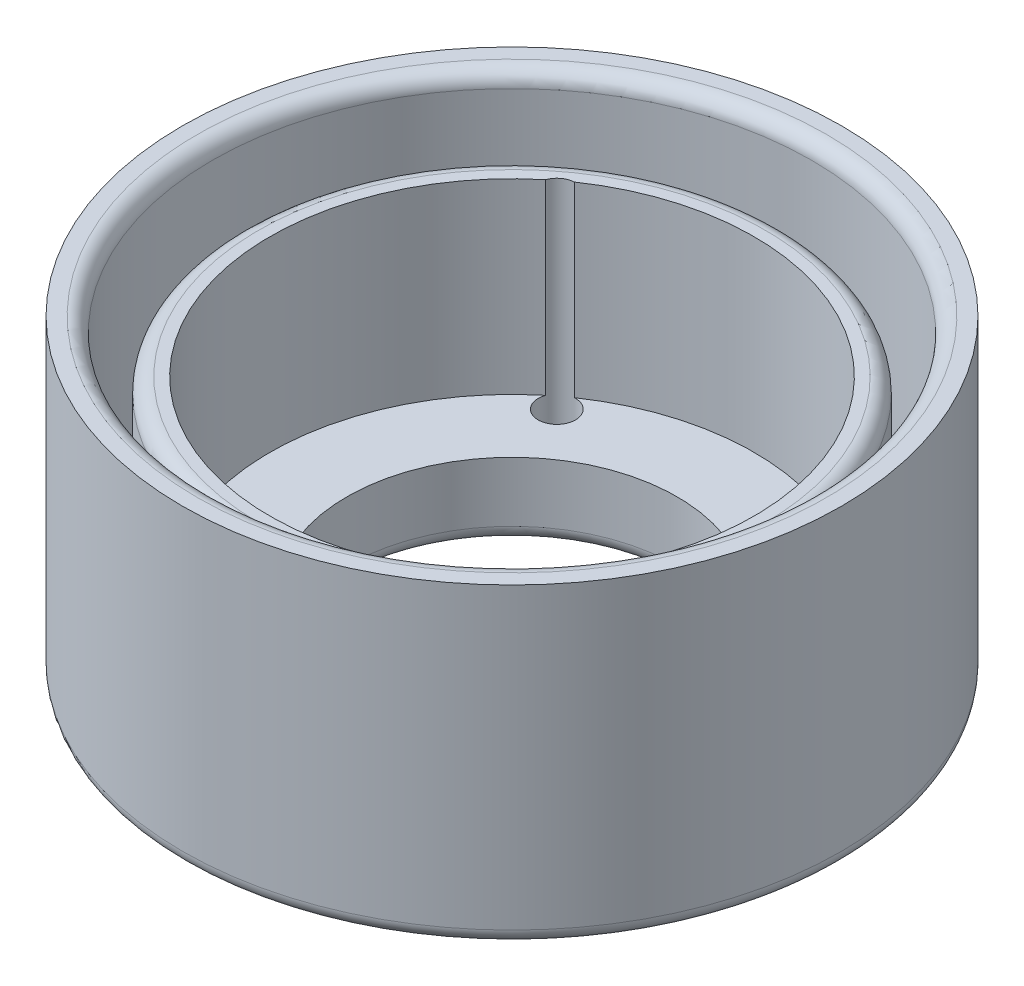
from build123d import *

# Parameters (mm, degrees)
CROQUIS1_R              = 22.05
CROQUIS1_R_2            = 20.05
SALIENTE_EXTRUIR1_DEPTH = 16
CROQUIS1_4_R            = 17.95
CROQUIS1_4_R_2          = 16.2
SALIENTE_EXTRUIR2_DEPTH = 12.5
SALIENTE_EXTRUIR4_START = -5
CROQUIS1_6_R            = 22.05
SALIENTE_EXTRUIR4_DEPTH = 5
CORTAR_EXTRUIR1_REACH   = 39.595
CROQUIS4_R              = 11.05
CROQUIS4_R_2            = 1.25
CROQUIS5_R              = 2.5
CROQUIS5_R_2            = 1.25
CORTAR_EXTRUIR2_DEPTH   = 3
REDONDEO1_R             = 1
REDONDEO3_R             = 1
REDONDEO4_R             = 1


with BuildPart() as part:
    # Croquis1 → Saliente-Extruir1 (new body)
    with BuildSketch(Plane(origin=(0, 0, 0), x_dir=(1, 0, 0), z_dir=(0, 1, 0))):
        Circle(CROQUIS1_R)
        Circle(CROQUIS1_R_2, mode=Mode.SUBTRACT)
    extrude(amount=SALIENTE_EXTRUIR1_DEPTH)



with BuildPart() as body_2:
    # Croquis1<4> → Saliente-Extruir2 (new body)
    with BuildSketch(Plane(origin=(0, 0, 0), x_dir=(1, 0, 0), z_dir=(0, 1, 0))):
        Circle(CROQUIS1_4_R)
        Circle(CROQUIS1_4_R_2, mode=Mode.SUBTRACT)
    extrude(amount=SALIENTE_EXTRUIR2_DEPTH)


with BuildPart() as part_1:
    add(part.part)

    add(body_2.part)  # Saliente-Extruir4 merges body 2
    # Croquis1<6> → Saliente-Extruir4 (add)
    with BuildSketch(Plane(origin=(0, 0, 0), x_dir=(1, 0, 0), z_dir=(0, 1, 0)).offset(SALIENTE_EXTRUIR4_START)):
        Circle(CROQUIS1_6_R)
    extrude(amount=SALIENTE_EXTRUIR4_DEPTH)

    # Croquis4 → Cortar-Extruir1 (cut, up to next)
    with BuildSketch(Plane.XZ.offset(5), mode=Mode.PRIVATE) as cortar_extruir1_sk1:
        Circle(CROQUIS4_R)
    cortar_extruir1_tool1 = extrude(cortar_extruir1_sk1.sketch, amount=-CORTAR_EXTRUIR1_REACH, mode=Mode.PRIVATE) & part_1.part
    # Croquis4 → Cortar-Extruir1 (cut, up to next)
    with BuildSketch(Plane.XZ.offset(5), mode=Mode.PRIVATE) as cortar_extruir1_sk2:
        with Locations((9.1, 12.1)):
            Circle(CROQUIS4_R_2)
    cortar_extruir1_tool2 = extrude(cortar_extruir1_sk2.sketch, amount=-CORTAR_EXTRUIR1_REACH, mode=Mode.PRIVATE) & part_1.part
    # Croquis4 → Cortar-Extruir1 (cut, up to next)
    with BuildSketch(Plane.XZ.offset(5), mode=Mode.PRIVATE) as cortar_extruir1_sk3:
        with Locations((-9.1, -12.1)):
            Circle(CROQUIS4_R_2)
    cortar_extruir1_tool3 = extrude(cortar_extruir1_sk3.sketch, amount=-CORTAR_EXTRUIR1_REACH, mode=Mode.PRIVATE) & part_1.part
    add(cortar_extruir1_tool1.solids().sort_by_distance((0, -5, 0))[0], mode=Mode.SUBTRACT)
    add(cortar_extruir1_tool2.solids().sort_by_distance((9.1, -5, 12.1))[0], mode=Mode.SUBTRACT)
    add(cortar_extruir1_tool3.solids().sort_by_distance((-9.1, -5, -12.1))[0], mode=Mode.SUBTRACT)

    # Croquis5 → Cortar-Extruir2 (cut)
    # profile 1 of 2: a face of its own
    with BuildSketch(Plane.XZ.offset(5)):
        with Locations((9.1, 12.1)):
            Circle(CROQUIS5_R)
        with Locations((9.1, 12.1)):
            Circle(CROQUIS5_R_2, mode=Mode.SUBTRACT)
    # profile 2 of 2: a face of its own
    with BuildSketch(Plane.XZ.offset(5)):
        with Locations((-9.1, -12.1)):
            Circle(CROQUIS5_R)
        with Locations((-9.1, -12.1)):
            Circle(CROQUIS5_R_2, mode=Mode.SUBTRACT)
    extrude(amount=-CORTAR_EXTRUIR2_DEPTH, mode=Mode.SUBTRACT)

    # Redondeo1
    redondeo1_edges = [part_1.edges().sort_by_distance(p)[0] for p in [
        (-11.05, -5, 0),
    ]]
    fillet(redondeo1_edges, radius=REDONDEO1_R)

    # Redondeo3
    redondeo3_edges = [part_1.edges().sort_by_distance(p)[0] for p in [
        (-22.05, -5, 0),
    ]]
    fillet(redondeo3_edges, radius=REDONDEO3_R)

    # Redondeo4
    redondeo4_edges = [part_1.edges().sort_by_distance(p)[0] for p in [
        (-20.05, 16, 0),
        (-17.95, 12.5, 0),
    ]]
    fillet(redondeo4_edges, radius=REDONDEO4_R)


solid = part_1.part
